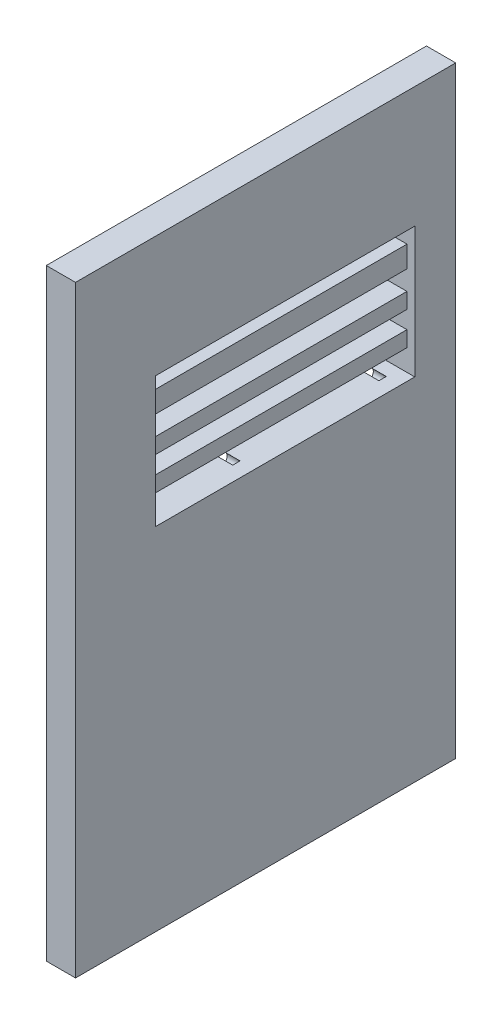
from build123d import *

# Parameters (mm, degrees)
CROQUIS1_W                 = 309
CROQUIS1_H                 = 195
CROQUIS1_W_2               = 11
CROQUIS1_H_2               = 133
CROQUIS1_W_3               = 9
CROQUIS1_W_4               = 10
SALIENTE_EXTRUIR1_DEPTH    = 15
CROQUIS2_W                 = 67
CROQUIS2_H                 = 133
CORTAR_EXTRUIR2_DEPTH      = 4
CORTAR_EXTRUIR3_DEPTH      = 366.69249377
CORTAR_EXTRUIR3_DEPTH_BACK = 7.5
CROQUIS3_R                 = 2.75


with BuildPart() as part:
    # Croquis1 → Saliente-Extruir1 (new body)
    with BuildSketch(Plane.YZ):
        with Locations((154.5, 97.5)):
            Rectangle(CROQUIS1_W, CROQUIS1_H)
        with Locations((185.5, 87.5)):
            Rectangle(CROQUIS1_W_2, CROQUIS1_H_2, mode=Mode.SUBTRACT)
        with Locations((203.5, 87.5)):
            Rectangle(CROQUIS1_W_3, CROQUIS1_H_2, mode=Mode.SUBTRACT)
        with Locations((221, 87.5)):
            Rectangle(CROQUIS1_W_4, CROQUIS1_H_2, mode=Mode.SUBTRACT)
        with Locations((242, 87.5)):
            Rectangle(CROQUIS1_W_4, CROQUIS1_H_2, mode=Mode.SUBTRACT)
    extrude(amount=SALIENTE_EXTRUIR1_DEPTH)

    # Croquis2 → Cortar-Extruir2 (cut)
    with BuildSketch(Plane.YZ.offset(15)):
        with Locations((213.5, 87.5)):
            Rectangle(CROQUIS2_W, CROQUIS2_H)
    extrude(amount=-CORTAR_EXTRUIR2_DEPTH, mode=Mode.SUBTRACT)

    # Croquis3 → Cortar-Extruir3 (cut, two sides: drawn at the far end of the back side and taken through both)
    with BuildSketch(Plane(origin=(0, 0, 0), x_dir=(0, -1, 0), z_dir=(-1, 0, 0)).offset(-CORTAR_EXTRUIR3_DEPTH_BACK)):
        with Locations(Location((-116, 105, 0), (0, 0, 270))):
            Circle(CROQUIS3_R)
        with Locations(Location((-64, 105, 0), (0, 0, 270))):
            Circle(CROQUIS3_R)
        with Locations(Location((-64, 30, 0), (0, 0, 270))):
            Circle(CROQUIS3_R)
        with Locations((-178, 105)):
            Circle(CROQUIS3_R)
        with Locations((-178, 30)):
            Circle(CROQUIS3_R)
        with Locations(Location((-116, 30, 0), (0, 0, 270))):
            Circle(CROQUIS3_R)
    extrude(amount=CORTAR_EXTRUIR3_DEPTH + CORTAR_EXTRUIR3_DEPTH_BACK, mode=Mode.SUBTRACT)


solid = part.part
